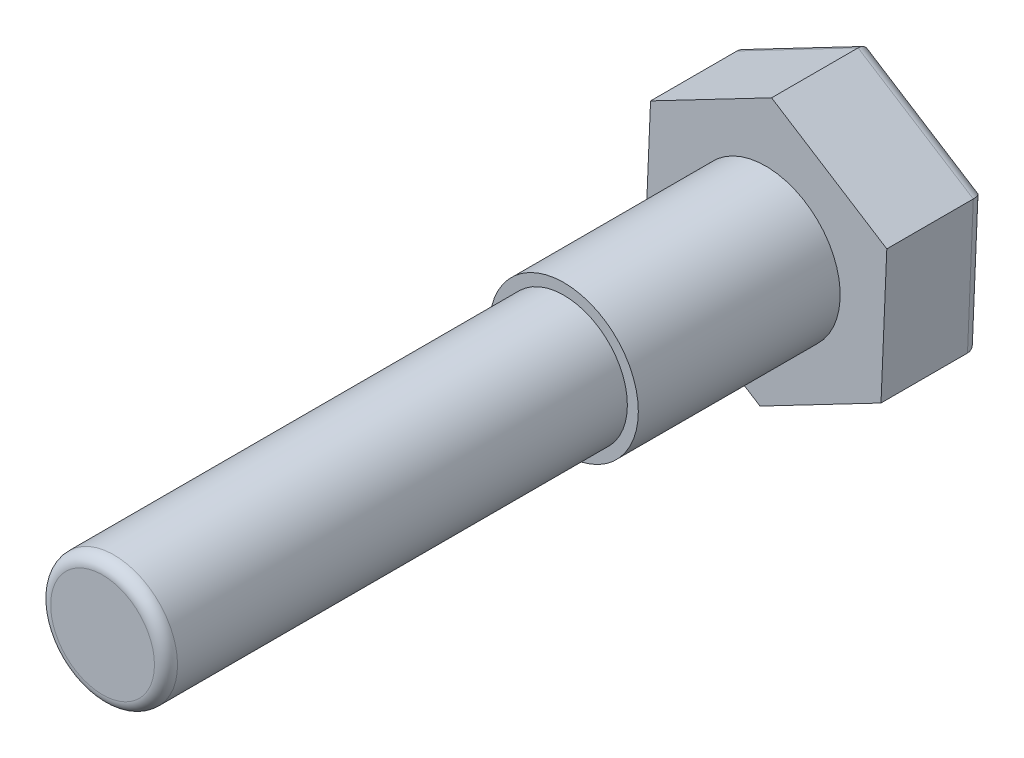
from build123d import *

# Parameters (mm, degrees)
EXTRUDE_276_DEPTH = 17
SKETCH_2_R        = 12.9
EXTRUDE_1_DEPTH   = 35
FILLET_3_R        = 2
SKETCH_3_R        = 11
EXTRUDE_2_DEPTH   = 80
FILLET_4_R        = 2


with BuildPart() as part:
    # 草图1 → Extrude 276 (new body)
    with BuildSketch(Plane.XY):
        Polygon((20.984201837, 10.954296262), (1.005402075, 23.65), (-19.978799762, 12.695703738), (-20.984201837, -10.954296262), (-1.005402075, -23.65), (19.978799762, -12.695703738), align=None)
    extrude(amount=EXTRUDE_276_DEPTH)

    # 草图2 → 凸台-拉伸1 (add)
    with BuildSketch(Plane.XY.offset(17)):
        with Locations(Location((0, 0, 0), (0, 0, 180))):
            Circle(SKETCH_2_R)
    extrude(amount=EXTRUDE_1_DEPTH)

    # 圆角3
    fillet_3_edges = [part.edges().sort_by_distance(p)[0] for p in [
        (9.486698843, -18.172851869, 0),
        (-10.994801956, -17.302148131, 0),
        (-20.4815008, 0.870703738, 0),
        (-9.486698843, 18.172851869, 0),
        (10.994801956, 17.302148131, 0),
        (20.4815008, -0.870703738, 0),
    ]]
    fillet(fillet_3_edges, radius=FILLET_3_R)

    # 草图3 → 凸台-拉伸2 (add)
    with BuildSketch(Plane.XY.offset(52)):
        Circle(SKETCH_3_R)
    extrude(amount=EXTRUDE_2_DEPTH)

    # 圆角4
    fillet_4_edges = [part.edges().sort_by_distance(p)[0] for p in [
        (-11, 0, 132),
    ]]
    fillet(fillet_4_edges, radius=FILLET_4_R)


solid = part.part
